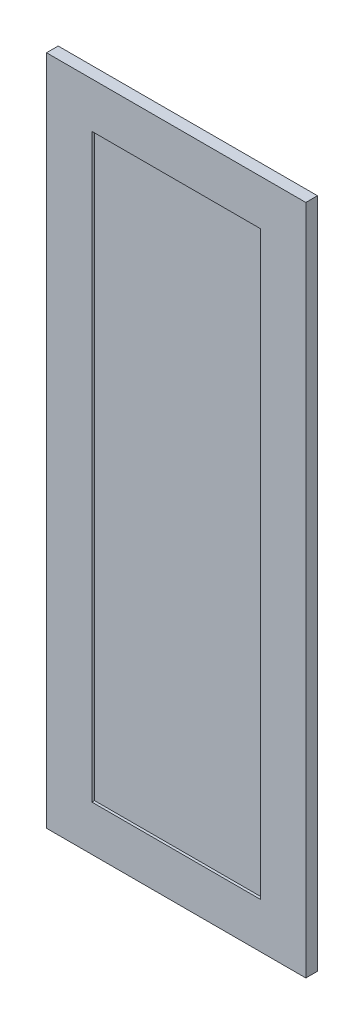
from build123d import *

# Parameters (mm, degrees)
SKETCH1_W           = 400
SKETCH1_H           = 1036
BOSS_EXTRUDE1_DEPTH = 18
SKETCH2_W           = 260
SKETCH2_H           = 896
CUT_EXTRUDE1_DEPTH  = 4


with BuildPart() as part:
    # Sketch1 → Boss-Extrude1 (new body)
    with BuildSketch(Plane.XY):
        Rectangle(SKETCH1_W, SKETCH1_H)
    extrude(amount=BOSS_EXTRUDE1_DEPTH)

    # Sketch2 → Cut-Extrude1 (cut)
    with BuildSketch(Plane.XY.offset(18)):
        Rectangle(SKETCH2_W, SKETCH2_H)
    extrude(amount=-CUT_EXTRUDE1_DEPTH, mode=Mode.SUBTRACT)


solid = part.part
